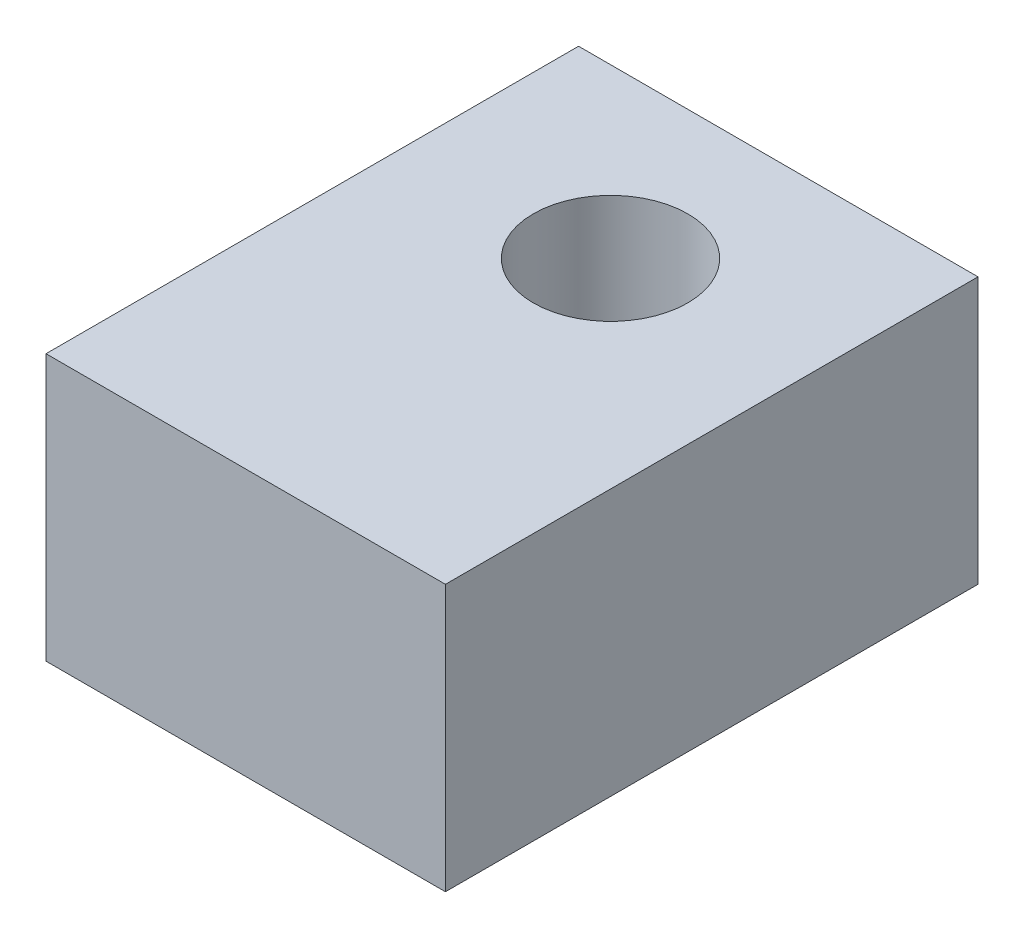
from build123d import *

# Parameters (mm, degrees)
SKETCH1_W           = 10
SKETCH1_H           = 15
BOSS_EXTRUDE1_DEPTH = 20
SKETCH3_R           = 2.9
CUT_EXTRUDE1_DEPTH  = 27.925824036


with BuildPart() as part:
    # Sketch1 → Boss-Extrude1 (new body)
    with BuildSketch(Plane(origin=(0, 0, 0), x_dir=(0, 1, 0), z_dir=(0, 0, 1))):
        with Locations((5, 7.5)):
            Rectangle(SKETCH1_W, SKETCH1_H)
    extrude(amount=BOSS_EXTRUDE1_DEPTH)

    # Sketch3 → Cut-Extrude1 (cut, through all)
    with BuildSketch(Plane(origin=(0, 10, 0), x_dir=(1, 0, 0), z_dir=(0, 1, 0))):
        with Locations(Location((-7.5, -6.3, 0), (0, 0, 180))):
            Circle(SKETCH3_R)
    extrude(amount=-CUT_EXTRUDE1_DEPTH, mode=Mode.SUBTRACT)


solid = part.part
